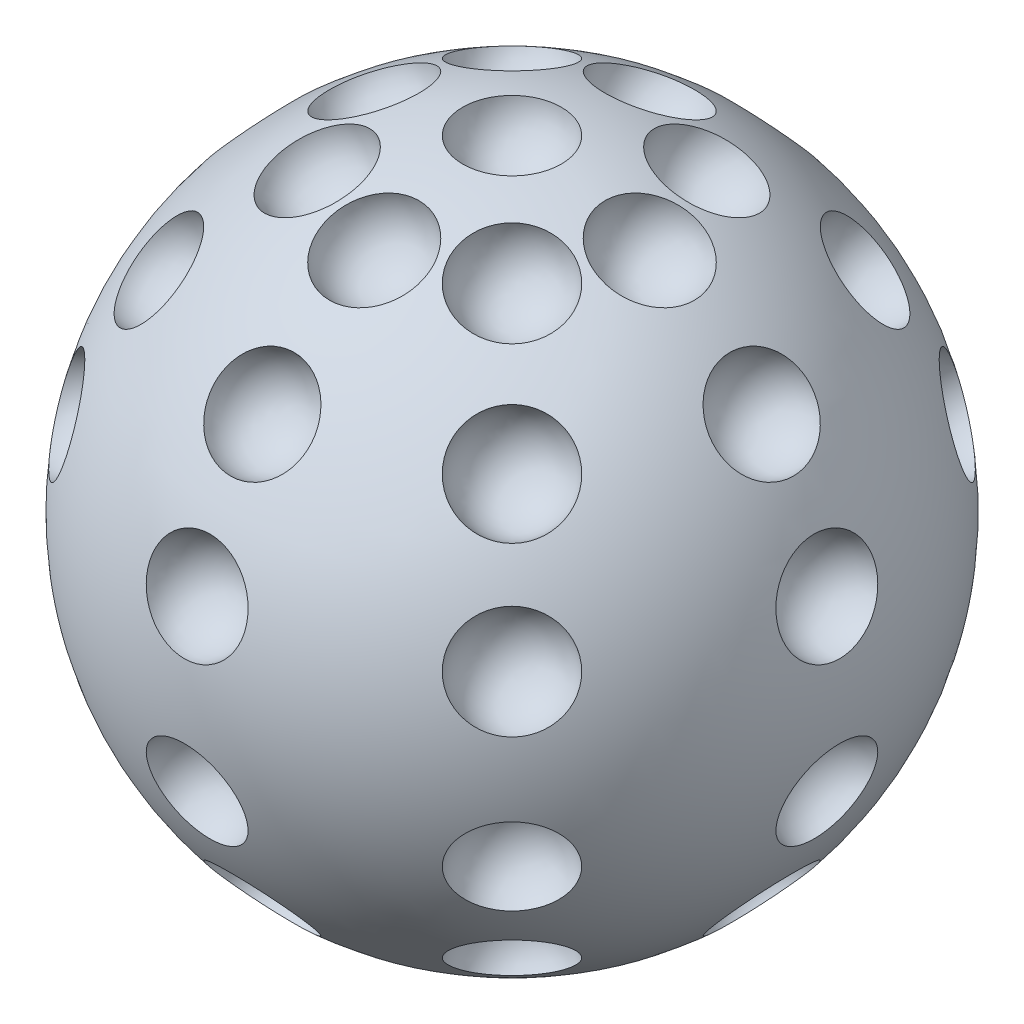
from build123d import *

# Parameters (mm, degrees)
CIRPATTERN1_COUNT = 4
CIRPATTERN1_ANGLE = 75


with BuildPart() as part:
    # Sketch1 → Revolve1 (revolve)
    with BuildSketch(Plane.XY, mode=Mode.PRIVATE) as revolve1_sk:
        with BuildLine():
            ThreePointArc((0, 20), (14.142135624, 14.142135624), (20, 0))
            Line((20, 0), (0, 0))
            Line((0, 0), (0, 20))
        make_face()
    revolve(revolve1_sk.sketch.rotate(Axis((0, 0, 0), (0, 1, 0)), 180), axis=Axis((0, 0, 0), (0, 1, 0)))

    # Sketch2 → Cut-Revolve1 (revolve, cut)
    with BuildSketch(Plane(origin=(0, 0, 0), x_dir=(0, 0, -1), z_dir=(1, 0, 0)), mode=Mode.PRIVATE) as cut_revolve1_sk:
        with BuildLine():
            Line((0, 17), (0, 20))
            ThreePointArc((0, 20), (-1.5, 19.943670675), (-2.991550601, 19.775))
            ThreePointArc((-2.991550601, 19.775), (-2.040220576, 17.800568255), (0, 17))
        make_face()
    cut_revolve1 = revolve(cut_revolve1_sk.sketch.rotate(Axis((0, 17, 0), (0, 1, 0)), 180), axis=Axis((0, 17, 0), (0, 1, 0)), mode=Mode.SUBTRACT)

    # CirPattern1: Cut-Revolve1 ×4 about axis
    cirpattern1_axis = Axis((0, 0, 0), (1, 0, 0))
    for i in range(1, CIRPATTERN1_COUNT):
        add(cut_revolve1.rotate(cirpattern1_axis, i * CIRPATTERN1_ANGLE / (CIRPATTERN1_COUNT - 1)), mode=Mode.SUBTRACT)

    # CirPattern2 copy 1 sketch → CirPattern2 copy 1 (revolve, cut)
    with BuildSketch(Plane(origin=(0, 0, 0), x_dir=(-0.6408563820557882, 0.42261826174070016, -0.6408563820557883), z_dir=(0.7071067811865476, 0, -0.7071067811865475))):
        with BuildLine():
            Line((0, 17), (0, 20))
            ThreePointArc((0, 20), (-1.5, 19.943670675), (-2.991550601, 19.775))
            ThreePointArc((-2.991550601, 19.775), (-2.040220576, 17.800568255), (0, 17))
        make_face()
    revolve(axis=Axis((5.080216058, 15.40723238, 5.080216058), (0.29883623873012033, 0.9063077870366496, 0.2988362387301204)), mode=Mode.SUBTRACT)

    # CirPattern2 copy 2 sketch → CirPattern2 copy 2 (revolve, cut)
    with BuildSketch(Plane(origin=(0, 0, 0), x_dir=(-0.9063077870366496, 0.42261826174070016, 0), z_dir=(0, 0, -1))):
        with BuildLine():
            Line((0, 17), (0, 20))
            ThreePointArc((0, 20), (-1.5, 19.943670675), (-2.991550601, 19.775))
            ThreePointArc((-2.991550601, 19.775), (-2.040220576, 17.800568255), (0, 17))
        make_face()
    revolve(axis=Axis((7.18451045, 15.40723238, 0), (0.42261826174070016, 0.9063077870366496, 0)), mode=Mode.SUBTRACT)

    # CirPattern2 copy 3 sketch → CirPattern2 copy 3 (revolve, cut)
    with BuildSketch(Plane(origin=(0, 0, 0), x_dir=(-0.6408563820557883, 0.42261826174070016, 0.6408563820557882), z_dir=(-0.7071067811865475, 0, -0.7071067811865476))):
        with BuildLine():
            Line((0, 17), (0, 20))
            ThreePointArc((0, 20), (-1.5, 19.943670675), (-2.991550601, 19.775))
            ThreePointArc((-2.991550601, 19.775), (-2.040220576, 17.800568255), (0, 17))
        make_face()
    revolve(axis=Axis((5.080216058, 15.40723238, -5.080216058), (0.2988362387301204, 0.9063077870366496, -0.29883623873012033)), mode=Mode.SUBTRACT)

    # CirPattern2 copy 4 sketch → CirPattern2 copy 4 (revolve, cut)
    with BuildSketch(Plane(origin=(0, 0, 0), x_dir=(0, 0.42261826174070016, 0.9063077870366496), z_dir=(-1, 0, 0))):
        with BuildLine():
            Line((0, 17), (0, 20))
            ThreePointArc((0, 20), (-1.5, 19.943670675), (-2.991550601, 19.775))
            ThreePointArc((-2.991550601, 19.775), (-2.040220576, 17.800568255), (0, 17))
        make_face()
    revolve(axis=Axis((0, 15.40723238, -7.18451045), (0, 0.9063077870366496, -0.42261826174070016)), mode=Mode.SUBTRACT)

    # CirPattern2 copy 5 sketch → CirPattern2 copy 5 (revolve, cut)
    with BuildSketch(Plane(origin=(0, 0, 0), x_dir=(0.6408563820557882, 0.42261826174070016, 0.6408563820557884), z_dir=(-0.7071067811865477, 0, 0.7071067811865475))):
        with BuildLine():
            Line((0, 17), (0, 20))
            ThreePointArc((0, 20), (-1.5, 19.943670675), (-2.991550601, 19.775))
            ThreePointArc((-2.991550601, 19.775), (-2.040220576, 17.800568255), (0, 17))
        make_face()
    revolve(axis=Axis((-5.080216058, 15.40723238, -5.080216058), (-0.29883623873012033, 0.9063077870366496, -0.2988362387301204)), mode=Mode.SUBTRACT)

    # CirPattern2 copy 6 sketch → CirPattern2 copy 6 (revolve, cut)
    with BuildSketch(Plane(origin=(0, 0, 0), x_dir=(0.9063077870366496, 0.42261826174070016, 0), z_dir=(0, 0, 1))):
        with BuildLine():
            Line((0, 17), (0, 20))
            ThreePointArc((0, 20), (-1.5, 19.943670675), (-2.991550601, 19.775))
            ThreePointArc((-2.991550601, 19.775), (-2.040220576, 17.800568255), (0, 17))
        make_face()
    revolve(axis=Axis((-7.18451045, 15.40723238, 0), (-0.42261826174070016, 0.9063077870366496, 0)), mode=Mode.SUBTRACT)

    # CirPattern2 copy 7 sketch → CirPattern2 copy 7 (revolve, cut)
    with BuildSketch(Plane(origin=(0, 0, 0), x_dir=(0.6408563820557884, 0.42261826174070016, -0.6408563820557881), z_dir=(0.7071067811865474, 0, 0.7071067811865477))):
        with BuildLine():
            Line((0, 17), (0, 20))
            ThreePointArc((0, 20), (-1.5, 19.943670675), (-2.991550601, 19.775))
            ThreePointArc((-2.991550601, 19.775), (-2.040220576, 17.800568255), (0, 17))
        make_face()
    revolve(axis=Axis((-5.080216058, 15.40723238, 5.080216058), (-0.2988362387301204, 0.9063077870366496, 0.2988362387301203)), mode=Mode.SUBTRACT)

    # CirPattern2 copy 8 sketch → CirPattern2 copy 8 (revolve, cut)
    with BuildSketch(Plane(origin=(0, 0, 0), x_dir=(-0.4545194776720427, 0.7660444431189791, -0.4545194776720428), z_dir=(0.7071067811865476, 0, -0.7071067811865475))):
        with BuildLine():
            Line((0, 17), (0, 20))
            ThreePointArc((0, 20), (-1.5, 19.943670675), (-2.991550601, 19.775))
            ThreePointArc((-2.991550601, 19.775), (-2.040220576, 17.800568255), (0, 17))
        make_face()
    revolve(axis=Axis((9.208478747, 10.927389365, 9.208478747), (0.5416752204197026, 0.642787609686538, 0.5416752204197026)), mode=Mode.SUBTRACT)

    # CirPattern2 copy 9 sketch → CirPattern2 copy 9 (revolve, cut)
    with BuildSketch(Plane(origin=(0, 0, 0), x_dir=(-0.642787609686538, 0.7660444431189791, 0), z_dir=(0, 0, -1))):
        with BuildLine():
            Line((0, 17), (0, 20))
            ThreePointArc((0, 20), (-1.5, 19.943670675), (-2.991550601, 19.775))
            ThreePointArc((-2.991550601, 19.775), (-2.040220576, 17.800568255), (0, 17))
        make_face()
    revolve(axis=Axis((13.022755533, 10.927389365, 0), (0.7660444431189791, 0.642787609686538, 0)), mode=Mode.SUBTRACT)

    # CirPattern2 copy 10 sketch → CirPattern2 copy 10 (revolve, cut)
    with BuildSketch(Plane(origin=(0, 0, 0), x_dir=(-0.4545194776720428, 0.7660444431189791, 0.4545194776720427), z_dir=(-0.7071067811865475, 0, -0.7071067811865476))):
        with BuildLine():
            Line((0, 17), (0, 20))
            ThreePointArc((0, 20), (-1.5, 19.943670675), (-2.991550601, 19.775))
            ThreePointArc((-2.991550601, 19.775), (-2.040220576, 17.800568255), (0, 17))
        make_face()
    revolve(axis=Axis((9.208478747, 10.927389365, -9.208478747), (0.5416752204197026, 0.642787609686538, -0.5416752204197026)), mode=Mode.SUBTRACT)

    # CirPattern2 copy 11 sketch → CirPattern2 copy 11 (revolve, cut)
    with BuildSketch(Plane(origin=(0, 0, 0), x_dir=(0, 0.7660444431189791, 0.642787609686538), z_dir=(-1, 0, 0))):
        with BuildLine():
            Line((0, 17), (0, 20))
            ThreePointArc((0, 20), (-1.5, 19.943670675), (-2.991550601, 19.775))
            ThreePointArc((-2.991550601, 19.775), (-2.040220576, 17.800568255), (0, 17))
        make_face()
    revolve(axis=Axis((0, 10.927389365, -13.022755533), (0, 0.642787609686538, -0.7660444431189791)), mode=Mode.SUBTRACT)

    # CirPattern2 copy 12 sketch → CirPattern2 copy 12 (revolve, cut)
    with BuildSketch(Plane(origin=(0, 0, 0), x_dir=(0.4545194776720427, 0.7660444431189791, 0.45451947767204287), z_dir=(-0.7071067811865477, 0, 0.7071067811865475))):
        with BuildLine():
            Line((0, 17), (0, 20))
            ThreePointArc((0, 20), (-1.5, 19.943670675), (-2.991550601, 19.775))
            ThreePointArc((-2.991550601, 19.775), (-2.040220576, 17.800568255), (0, 17))
        make_face()
    revolve(axis=Axis((-9.208478747, 10.927389365, -9.208478747), (-0.5416752204197026, 0.642787609686538, -0.5416752204197027)), mode=Mode.SUBTRACT)

    # CirPattern2 copy 13 sketch → CirPattern2 copy 13 (revolve, cut)
    with BuildSketch(Plane(origin=(0, 0, 0), x_dir=(0.642787609686538, 0.7660444431189791, 0), z_dir=(0, 0, 1))):
        with BuildLine():
            Line((0, 17), (0, 20))
            ThreePointArc((0, 20), (-1.5, 19.943670675), (-2.991550601, 19.775))
            ThreePointArc((-2.991550601, 19.775), (-2.040220576, 17.800568255), (0, 17))
        make_face()
    revolve(axis=Axis((-13.022755533, 10.927389365, 0), (-0.7660444431189791, 0.642787609686538, 0)), mode=Mode.SUBTRACT)

    # CirPattern2 copy 14 sketch → CirPattern2 copy 14 (revolve, cut)
    with BuildSketch(Plane(origin=(0, 0, 0), x_dir=(0.45451947767204287, 0.7660444431189791, -0.45451947767204265), z_dir=(0.7071067811865474, 0, 0.7071067811865477))):
        with BuildLine():
            Line((0, 17), (0, 20))
            ThreePointArc((0, 20), (-1.5, 19.943670675), (-2.991550601, 19.775))
            ThreePointArc((-2.991550601, 19.775), (-2.040220576, 17.800568255), (0, 17))
        make_face()
    revolve(axis=Axis((-9.208478747, 10.927389365, 9.208478747), (-0.5416752204197027, 0.642787609686538, 0.5416752204197025)), mode=Mode.SUBTRACT)

    # CirPattern2 copy 15 sketch → CirPattern2 copy 15 (revolve, cut)
    with BuildSketch(Plane(origin=(0, 0, 0), x_dir=(-0.18301270189221763, 0.965925826289069, -0.18301270189221766), z_dir=(0.7071067811865476, 0, -0.7071067811865475))):
        with BuildLine():
            Line((0, 17), (0, 20))
            ThreePointArc((0, 20), (-1.5, 19.943670675), (-2.991550601, 19.775))
            ThreePointArc((-2.991550601, 19.775), (-2.040220576, 17.800568255), (0, 17))
        make_face()
    revolve(axis=Axis((11.611215932, 4.399923767, 11.611215932), (0.6830127018922197, 0.2588190451025184, 0.6830127018922199)), mode=Mode.SUBTRACT)

    # CirPattern2 copy 16 sketch → CirPattern2 copy 16 (revolve, cut)
    with BuildSketch(Plane(origin=(0, 0, 0), x_dir=(-0.2588190451025184, 0.965925826289069, 0), z_dir=(0, 0, -1))):
        with BuildLine():
            Line((0, 17), (0, 20))
            ThreePointArc((0, 20), (-1.5, 19.943670675), (-2.991550601, 19.775))
            ThreePointArc((-2.991550601, 19.775), (-2.040220576, 17.800568255), (0, 17))
        make_face()
    revolve(axis=Axis((16.420739047, 4.399923767, 0), (0.965925826289069, 0.2588190451025184, 0)), mode=Mode.SUBTRACT)

    # CirPattern2 copy 17 sketch → CirPattern2 copy 17 (revolve, cut)
    with BuildSketch(Plane(origin=(0, 0, 0), x_dir=(-0.18301270189221766, 0.965925826289069, 0.18301270189221763), z_dir=(-0.7071067811865475, 0, -0.7071067811865476))):
        with BuildLine():
            Line((0, 17), (0, 20))
            ThreePointArc((0, 20), (-1.5, 19.943670675), (-2.991550601, 19.775))
            ThreePointArc((-2.991550601, 19.775), (-2.040220576, 17.800568255), (0, 17))
        make_face()
    revolve(axis=Axis((11.611215932, 4.399923767, -11.611215932), (0.6830127018922199, 0.2588190451025184, -0.6830127018922197)), mode=Mode.SUBTRACT)

    # CirPattern2 copy 18 sketch → CirPattern2 copy 18 (revolve, cut)
    with BuildSketch(Plane(origin=(0, 0, 0), x_dir=(0, 0.965925826289069, 0.2588190451025184), z_dir=(-1, 0, 0))):
        with BuildLine():
            Line((0, 17), (0, 20))
            ThreePointArc((0, 20), (-1.5, 19.943670675), (-2.991550601, 19.775))
            ThreePointArc((-2.991550601, 19.775), (-2.040220576, 17.800568255), (0, 17))
        make_face()
    revolve(axis=Axis((0, 4.399923767, -16.420739047), (0, 0.2588190451025184, -0.965925826289069)), mode=Mode.SUBTRACT)

    # CirPattern2 copy 19 sketch → CirPattern2 copy 19 (revolve, cut)
    with BuildSketch(Plane(origin=(0, 0, 0), x_dir=(0.18301270189221763, 0.965925826289069, 0.1830127018922177), z_dir=(-0.7071067811865477, 0, 0.7071067811865475))):
        with BuildLine():
            Line((0, 17), (0, 20))
            ThreePointArc((0, 20), (-1.5, 19.943670675), (-2.991550601, 19.775))
            ThreePointArc((-2.991550601, 19.775), (-2.040220576, 17.800568255), (0, 17))
        make_face()
    revolve(axis=Axis((-11.611215932, 4.399923767, -11.611215932), (-0.6830127018922197, 0.2588190451025184, -0.68301270189222)), mode=Mode.SUBTRACT)

    # CirPattern2 copy 20 sketch → CirPattern2 copy 20 (revolve, cut)
    with BuildSketch(Plane(origin=(0, 0, 0), x_dir=(0.2588190451025184, 0.965925826289069, 0), z_dir=(0, 0, 1))):
        with BuildLine():
            Line((0, 17), (0, 20))
            ThreePointArc((0, 20), (-1.5, 19.943670675), (-2.991550601, 19.775))
            ThreePointArc((-2.991550601, 19.775), (-2.040220576, 17.800568255), (0, 17))
        make_face()
    revolve(axis=Axis((-16.420739047, 4.399923767, 0), (-0.965925826289069, 0.2588190451025184, 0)), mode=Mode.SUBTRACT)

    # CirPattern2 copy 21 sketch → CirPattern2 copy 21 (revolve, cut)
    with BuildSketch(Plane(origin=(0, 0, 0), x_dir=(0.1830127018922177, 0.965925826289069, -0.1830127018922176), z_dir=(0.7071067811865474, 0, 0.7071067811865477))):
        with BuildLine():
            Line((0, 17), (0, 20))
            ThreePointArc((0, 20), (-1.5, 19.943670675), (-2.991550601, 19.775))
            ThreePointArc((-2.991550601, 19.775), (-2.040220576, 17.800568255), (0, 17))
        make_face()
    revolve(axis=Axis((-11.611215932, 4.399923767, 11.611215932), (-0.68301270189222, 0.2588190451025184, 0.6830127018922196)), mode=Mode.SUBTRACT)

    # Mirror1: part across plane


with BuildPart() as part_1:
    add(part.part)
    add(part.part.mirror(Plane(origin=(0, 0, 0), x_dir=(0, 0, 1), z_dir=(0, -1, 0))))


solid = part_1.part
